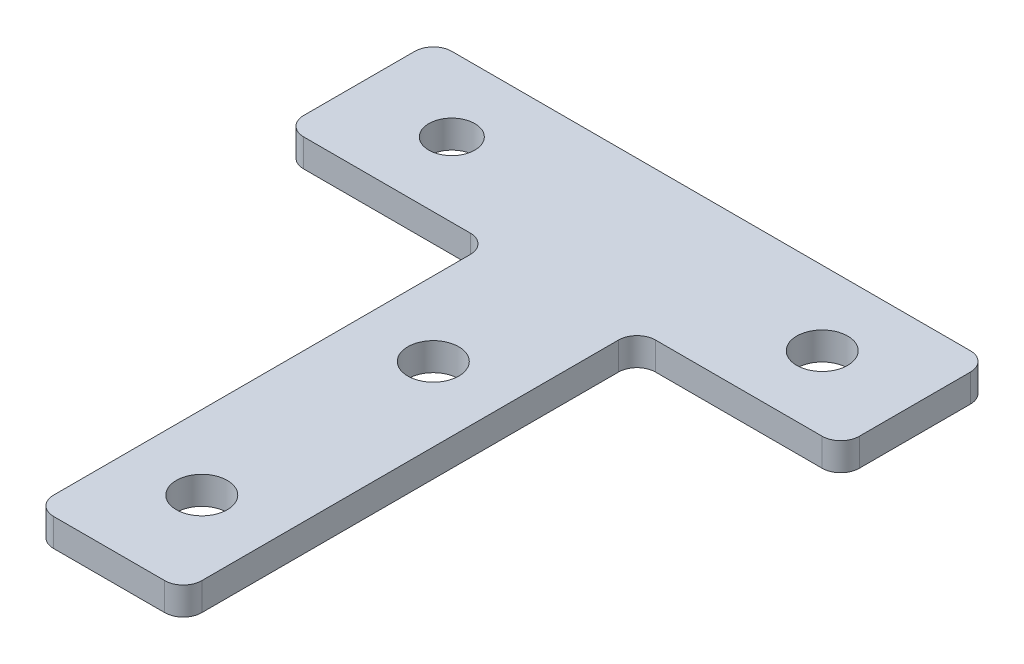
from build123d import *

# Parameters (mm, degrees)
SKETCH_1_R      = 2.485535924
SKETCH_1_R_2    = 2.75
EXTRUDE_1_DEPTH = 3


with BuildPart() as part:
    # 草图1 → 凸台-拉伸1 (new body)
    with BuildSketch(Plane(origin=(0, 0, 0), x_dir=(1, 0, 0), z_dir=(0, 1, 0))):
        with BuildLine():
            Line((0, -2), (0, -14))
            ThreePointArc((0, -14), (0.585786438, -15.414213562), (2, -16))
            Line((2, -16), (20, -16))
            ThreePointArc((20, -16), (21.414213562, -16.585786438), (22, -18))
            Line((22, -18), (22, -63))
            ThreePointArc((22, -63), (22.585786438, -64.414213562), (24, -65))
            Line((24, -65), (36, -65))
            ThreePointArc((36, -65), (37.414213562, -64.414213562), (38, -63))
            Line((38, -63), (38, -18))
            ThreePointArc((38, -18), (38.585786438, -16.585786438), (40, -16))
            Line((40, -16), (58, -16))
            ThreePointArc((58, -16), (59.414213562, -15.414213562), (60, -14))
            Line((60, -14), (60, -2))
            ThreePointArc((60, -2), (59.414213562, -0.585786438), (58, 0))
            Line((58, 0), (2, 0))
            ThreePointArc((2, 0), (0.585786438, -0.585786438), (0, -2))
        make_face()
        with Locations(Location((10, -8, 0), (0, 0, 270))):
            Circle(SKETCH_1_R, mode=Mode.SUBTRACT)
        with Locations(Location((50, -8, 0), (0, 0, 270))):
            Circle(SKETCH_1_R_2, mode=Mode.SUBTRACT)
        with Locations(Location((30, -55, 0), (0, 0, 270))):
            Circle(SKETCH_1_R_2, mode=Mode.SUBTRACT)
        with Locations(Location((30, -30, 0), (0, 0, 270))):
            Circle(SKETCH_1_R_2, mode=Mode.SUBTRACT)
    extrude(amount=EXTRUDE_1_DEPTH)


solid = part.part
